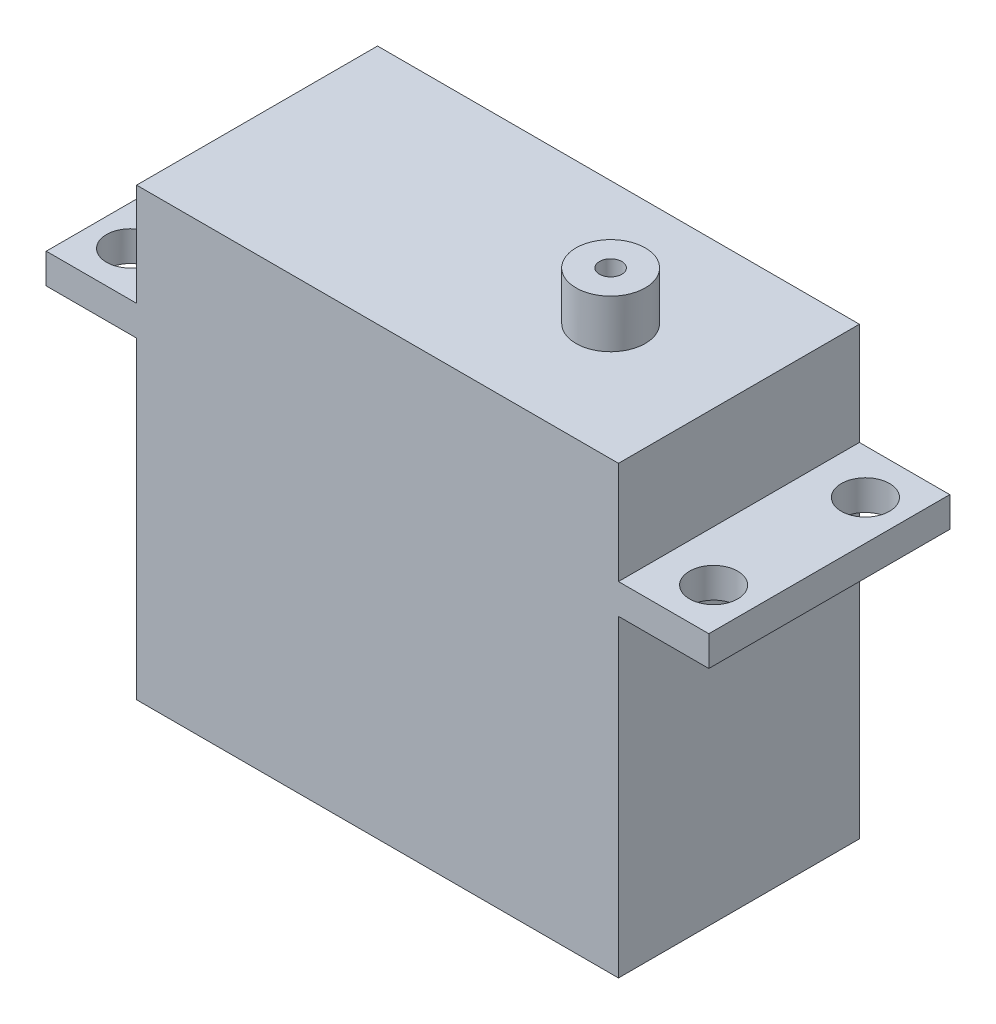
from build123d import *

# Parameters (mm, degrees)
SKETCH1_W                        = 40
SKETCH1_H                        = 20
BOSS_EXTRUDE1_DEPTH              = 37
SKETCH2_W                        = 7.5
SKETCH2_H                        = 20
BOSS_EXTRUDE2_DEPTH              = 2.5
F_4_0_4_DIAMETER_HOLE1_D         = 4
SKETCH5_R                        = 2.875
BOSS_EXTRUDE3_DEPTH              = 4
F_1_85_1_85_DIAMETER_HOLE1_D     = 1.85
F_1_85_1_85_DIAMETER_HOLE1_DEPTH = 4
F_1_85_1_85_DIAMETER_HOLE1_TIP   = 0.555796073


with BuildPart() as part:
    # Sketch1 → Boss-Extrude1 (new body)
    with BuildSketch(Plane(origin=(0, 0, 0), x_dir=(1, 0, 0), z_dir=(0, 1, 0))):
        Rectangle(SKETCH1_W, SKETCH1_H)
    extrude(amount=BOSS_EXTRUDE1_DEPTH)

    # Sketch2 → Boss-Extrude2 (add)
    with BuildSketch(Plane(origin=(0, 26, 0), x_dir=(1, 0, 0), z_dir=(0, 1, 0))):
        with Locations((23.75, 0)):
            Rectangle(SKETCH2_W, SKETCH2_H)
        with Locations((-23.75, 0)):
            Rectangle(SKETCH2_W, SKETCH2_H)
    extrude(amount=BOSS_EXTRUDE2_DEPTH)

    # Ø4.0 (4) Diameter Hole1 (through all)
    with Locations(Plane(origin=(0, 28.5, 0), x_dir=(1, 0, 0), z_dir=(0, 1, 0))):
        with Locations((-24.2, -6.3), (-24.2, 6.3), (24.2, 6.3), (24.2, -6.3)):
            Hole(F_4_0_4_DIAMETER_HOLE1_D / 2)

    # Sketch5 → Boss-Extrude3 (add)
    with BuildSketch(Plane(origin=(0, 37, 0), x_dir=(1, 0, 0), z_dir=(0, 1, 0))):
        with Locations(Location((9.625, -0.275, 0), (0, 0, 90))):
            Circle(SKETCH5_R)
    extrude(amount=BOSS_EXTRUDE3_DEPTH)

    # Ø1.85 (1.85) Diameter Hole1
    with Locations(Plane(origin=(0, 41, 0), x_dir=(1, 0, 0), z_dir=(0, 1, 0))):
        with Locations((9.625, -0.275)):
            Hole(F_1_85_1_85_DIAMETER_HOLE1_D / 2, depth=F_1_85_1_85_DIAMETER_HOLE1_DEPTH)
            with Locations((0, 0, -(F_1_85_1_85_DIAMETER_HOLE1_DEPTH + F_1_85_1_85_DIAMETER_HOLE1_TIP / 2))):  # 118° drill point
                Cone(0, F_1_85_1_85_DIAMETER_HOLE1_D / 2, F_1_85_1_85_DIAMETER_HOLE1_TIP, mode=Mode.SUBTRACT)


solid = part.part
